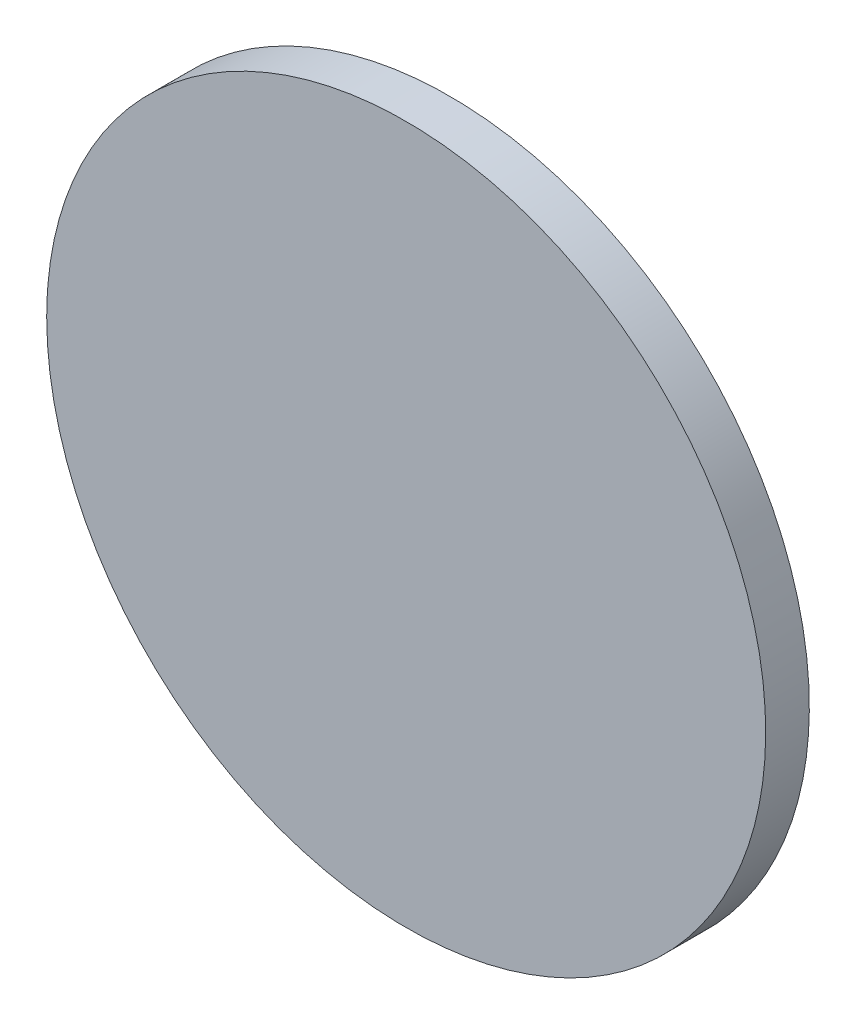
from build123d import *

# Parameters (mm, degrees)
SKETCH2_RX          = 26.154734702
SKETCH2_RY          = 25.4
BOSS_EXTRUDE1_DEPTH = 3.175


with BuildPart() as part:
    # Sketch2 → Boss-Extrude1 (new body)
    with BuildSketch(Plane.XY):
        with Locations(Location((0, 0), (0, 0, 180))):
            Ellipse(SKETCH2_RX, SKETCH2_RY)
    extrude(amount=BOSS_EXTRUDE1_DEPTH)


solid = part.part
